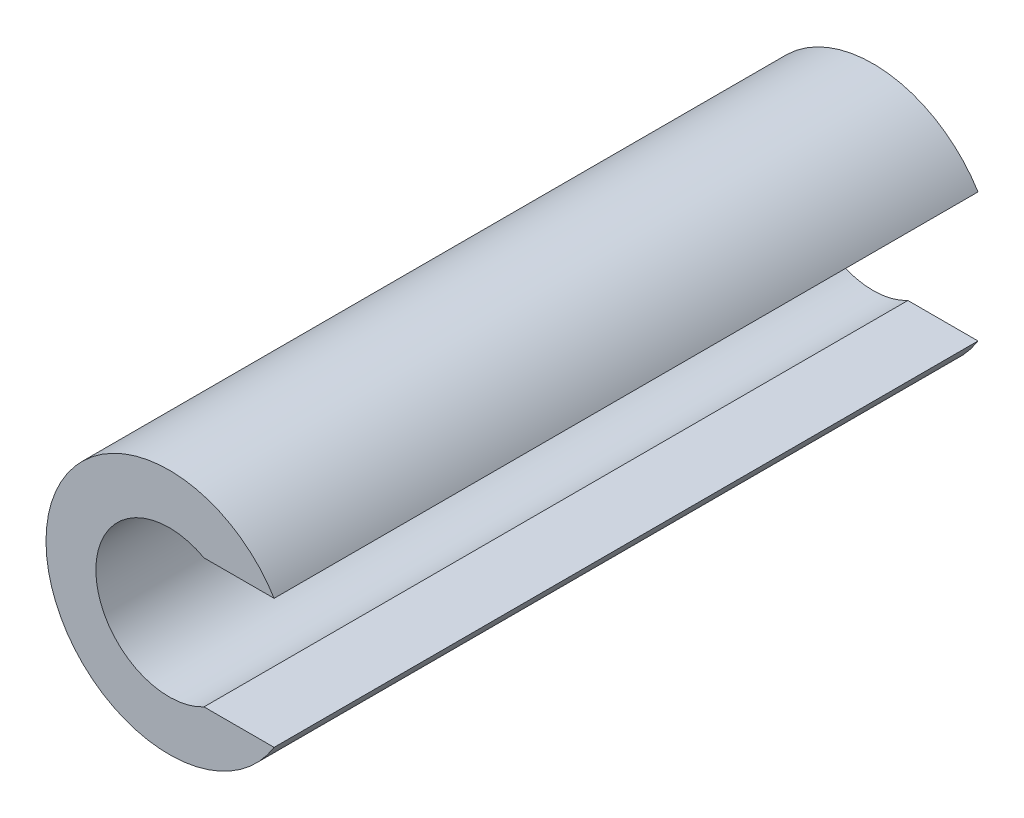
from build123d import *

# Parameters (mm, degrees)
SKETCH1_R               = 10.5
SKETCH1_R_2             = 6.25
SLEEVE_DEPTH            = 60
CLIP_OPENING_DEPTH      = 62.810193334
CLIP_OPENING_DEPTH_BACK = 62.810193334
SKETCH2_W               = 12
SKETCH2_H               = 11


with BuildPart() as part:
    # Sketch1 → Sleeve (new body)
    with BuildSketch(Plane.XY):
        Circle(SKETCH1_R)
        Circle(SKETCH1_R_2, mode=Mode.SUBTRACT)
    extrude(amount=SLEEVE_DEPTH)

    # Sketch2 → Clip_opening (cut, two sides: drawn at the far end of the back side and taken through both)
    with BuildSketch(Plane.XY.offset(-CLIP_OPENING_DEPTH_BACK)):
        with Locations((6, 0)):
            Rectangle(SKETCH2_W, SKETCH2_H)
    extrude(amount=CLIP_OPENING_DEPTH + CLIP_OPENING_DEPTH_BACK, mode=Mode.SUBTRACT)


solid = part.part
